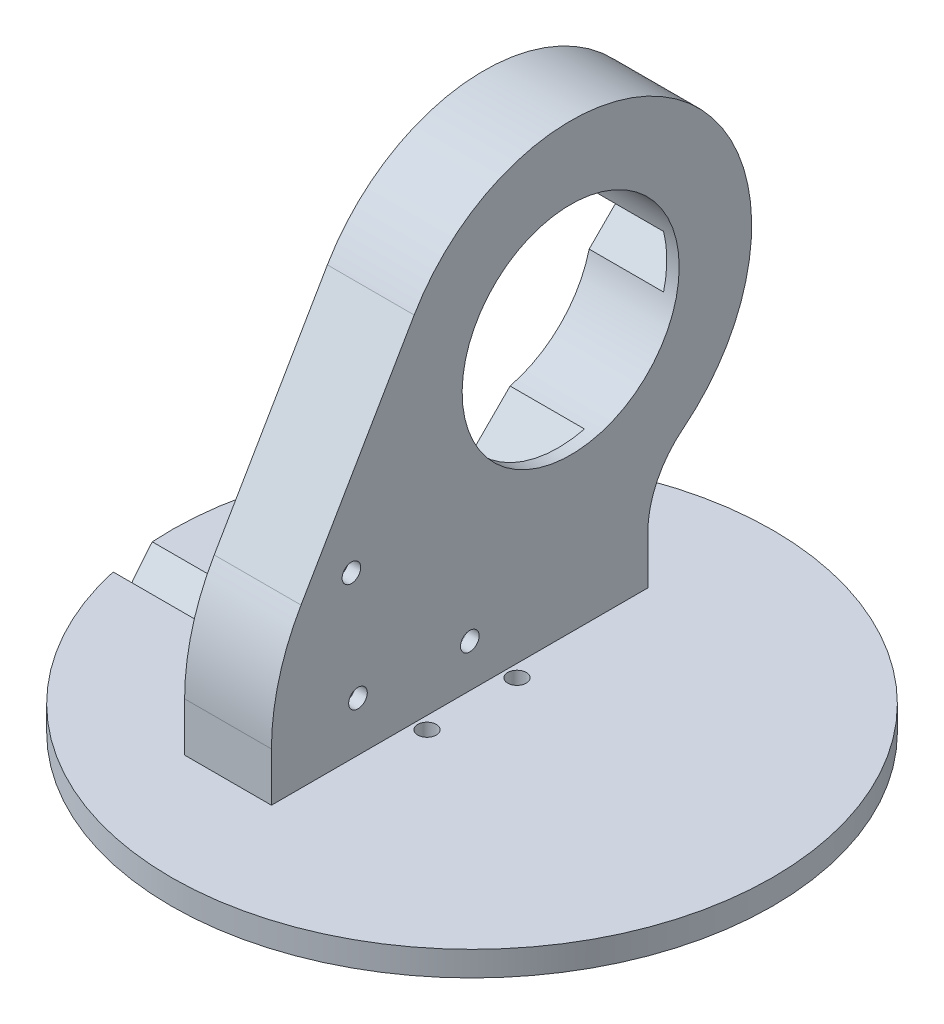
from build123d import *

# Parameters (mm, degrees)
SKETCH1_R               = 48.5
SKETCH1_R_2             = 1.5
BOSS_EXTRUDE1_DEPTH     = 4
CUT_EXTRUDE2_START      = -2.5
SKETCH2_R               = 3.75
CUT_EXTRUDE2_DEPTH      = 1.5
BOSS_EXTRUDE2_START     = -16
SKETCH3_R               = 17.5
BOSS_EXTRUDE2_DEPTH     = 14
CUT_EXTRUDE3_START      = -4
SKETCH6_R               = 15
CUT_EXTRUDE3_DEPTH      = 98.977942974
CUT_EXTRUDE4_DEPTH      = 104.939890578
CUT_EXTRUDE4_DEPTH_BACK = 104.939890578
SKETCH8_R               = 1.5


with BuildPart() as part:
    # Sketch1 → Boss-Extrude1 (new body)
    with BuildSketch(Plane(origin=(0, 0, 0), x_dir=(1, 0, 0), z_dir=(0, 1, 0))):
        with Locations(Location((0, 0, 0), (0, 0, 270))):
            Circle(SKETCH1_R)
        with Locations(Location((0, 7.25, 0), (0, 0, 270))):
            Circle(SKETCH1_R_2, mode=Mode.SUBTRACT)
        with Locations(Location((0, -7.25, 0), (0, 0, 270))):
            Circle(SKETCH1_R_2, mode=Mode.SUBTRACT)
    extrude(amount=BOSS_EXTRUDE1_DEPTH)

    # Sketch2 → Cut-Extrude2 (cut)
    with BuildSketch(Plane(origin=(0, 4, 0), x_dir=(1, 0, 0), z_dir=(0, 1, 0)).offset(CUT_EXTRUDE2_START)):
        with Locations(Location((0, 0, 0), (0, 0, 270))):
            Circle(SKETCH2_R)
    extrude(amount=-CUT_EXTRUDE2_DEPTH, mode=Mode.SUBTRACT)

    # Sketch3 → Boss-Extrude2 (add)
    with BuildSketch(Plane(origin=(0, 0, 0), x_dir=(0, 0, -1), z_dir=(1, 0, 0)).offset(BOSS_EXTRUDE2_START)):
        with BuildLine():
            Line((-30.34, 11.86), (-30.34, 4))
            Line((-30.34, 4), (30.34, 4))
            Line((30.34, 4), (30.34, 11.64))
            ThreePointArc((30.34, 11.64), (31.836685031, 18.171499434), (36.028064648, 23.399585877))
            ThreePointArc((36.028064648, 23.399585877), (37.018756945, 68.339760312), (-7.32065551, 60.949411697))
            Line((-7.32065551, 60.949411697), (-25.566364775, 29.567702977))
            ThreePointArc((-25.566364775, 29.567702977), (-29.125662797, 21.029928271), (-30.34, 11.86))
        make_face()
        with Locations((17.91, 46.28)):
            Circle(SKETCH3_R, mode=Mode.SUBTRACT)
    extrude(amount=BOSS_EXTRUDE2_DEPTH)

    # Sketch6 → Cut-Extrude3 (cut, through all)
    with BuildSketch(Plane(origin=(0, 0, 0), x_dir=(0, 0, -1), z_dir=(1, 0, 0)).offset(CUT_EXTRUDE3_START)):
        with BuildLine():
            Line((7.303398282, 56.886601718), (-28.051940777, 21.531262658))
            Line((-28.051940777, 21.531262658), (-6.838737342, 0.318059223))
            Line((-6.838737342, 0.318059223), (28.516601718, 35.673398282))
            ThreePointArc((28.516601718, 35.673398282), (7.303398282, 35.673398282), (7.303398282, 56.886601718))
        make_face()
        with Locations((17.91, 46.28)):
            Circle(SKETCH6_R)
        with BuildLine():
            ThreePointArc((32.91, 46.28), (31.768192988, 40.539748515), (28.516601718, 35.673398282))
            Line((28.516601718, 35.673398282), (39.123203436, 46.28))
            Line((39.123203436, 46.28), (28.516601718, 56.886601718))
            ThreePointArc((28.516601718, 56.886601718), (31.768192988, 52.020251485), (32.91, 46.28))
        make_face()
        with BuildLine():
            Line((17.91, 67.493203436), (7.303398282, 56.886601718))
            ThreePointArc((7.303398282, 56.886601718), (17.91, 61.28), (28.516601718, 56.886601718))
            Line((28.516601718, 56.886601718), (17.91, 67.493203436))
        make_face()
    extrude(amount=-CUT_EXTRUDE3_DEPTH, mode=Mode.SUBTRACT)

    # Sketch8 → Cut-Extrude4 (cut, two sides: drawn at the far end of the back side and taken through both)
    with BuildSketch(Plane.ZY.offset(4).offset(-CUT_EXTRUDE4_DEPTH_BACK)):
        with Locations((17.445339059, 30.016544033)):
            Circle(SKETCH8_R)
        with Locations((16.384678888, 11.985321112)):
            Circle(SKETCH8_R)
        with Locations((-1.646544033, 10.924660941)):
            Circle(SKETCH8_R)
    extrude(amount=CUT_EXTRUDE4_DEPTH + CUT_EXTRUDE4_DEPTH_BACK, mode=Mode.SUBTRACT)


solid = part.part
